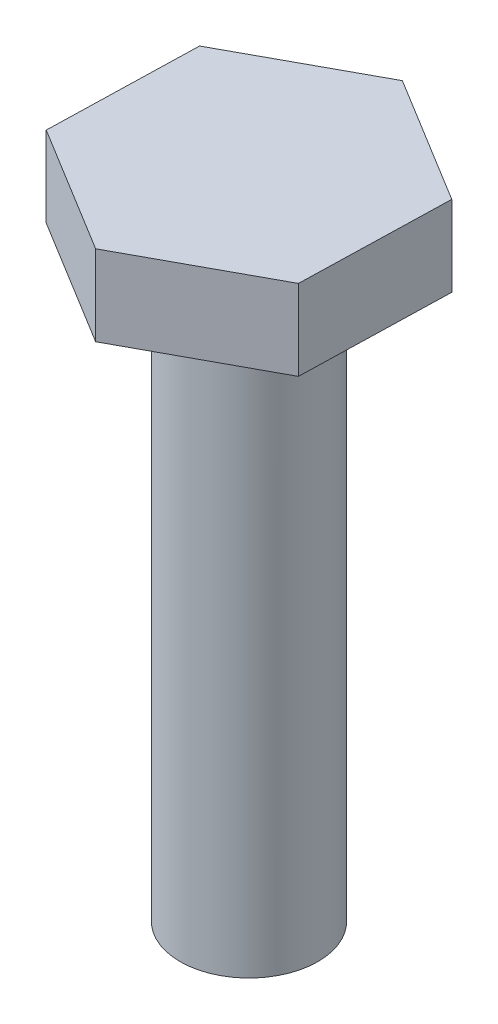
from build123d import *

# Parameters (mm, degrees)
BOSS_EXTRUDE1_DEPTH = 3.5
SKETCH2_R           = 3
BOSS_EXTRUDE2_DEPTH = 25


with BuildPart() as part:
    # Sketch1 → Boss-Extrude1 (new body)
    with BuildSketch(Plane(origin=(0, 0, 0), x_dir=(1, 0, 0), z_dir=(0, 1, 0))):
        Polygon((5.543350936, -3.394298218), (5.711223953, 3.103533624), (0.167873017, 6.497831842), (-5.543350936, 3.394298218), (-5.711223953, -3.103533624), (-0.167873017, -6.497831842), align=None)
    extrude(amount=BOSS_EXTRUDE1_DEPTH)

    # Sketch2 → Boss-Extrude2 (add)
    with BuildSketch(Plane.XZ):
        with Locations(Location((0, 0, 0), (0, 0, 90))):
            Circle(SKETCH2_R)
    extrude(amount=BOSS_EXTRUDE2_DEPTH)


solid = part.part
